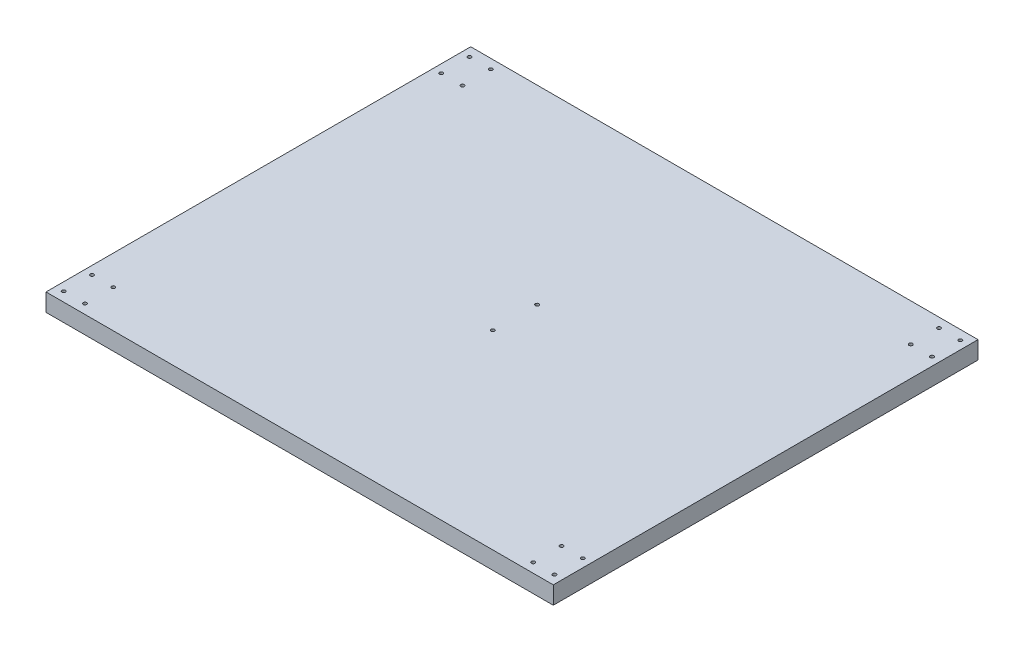
from build123d import *

# Parameters (mm, degrees)
CROQUIS1_W              = 430
CROQUIS1_H              = 360
CROQUIS1_R              = 1.5
SALIENTE_EXTRUIR1_DEPTH = 15
CROQUIS3_R              = 1.5
CORTAR_EXTRUIR1_DEPTH   = 281.802421642


with BuildPart() as part:
    # Croquis1 → Saliente-Extruir1 (new body)
    with BuildSketch(Plane(origin=(0, 0, 0), x_dir=(1, 0, 0), z_dir=(0, 1, 0))):
        Rectangle(CROQUIS1_W, CROQUIS1_H)
        with Locations(Location((2.5, 18.8, 0), (0, 0, 270))):
            Circle(CROQUIS1_R, mode=Mode.SUBTRACT)
        with Locations(Location((2.5, -18.8, 0), (0, 0, 270))):
            Circle(CROQUIS1_R, mode=Mode.SUBTRACT)
    extrude(amount=SALIENTE_EXTRUIR1_DEPTH)

    # Croquis3 → Cortar-Extruir1 (cut, through all)
    with BuildSketch(Plane(origin=(0, 15, 0), x_dir=(1, 0, 0), z_dir=(0, 1, 0))):
        with Locations(Location((208, -172, 0), (0, 0, 270))):
            Circle(CROQUIS3_R)
        with Locations(Location((190, -172, 0), (0, 0, 270))):
            Circle(CROQUIS3_R)
        with Locations(Location((190, -148, 0), (0, 0, 270))):
            Circle(CROQUIS3_R)
        with Locations(Location((208, -148, 0), (0, 0, 270))):
            Circle(CROQUIS3_R)
        with Locations(Location((-208, -172, 0), (0, 0, 90))):
            Circle(CROQUIS3_R)
        with Locations(Location((-190, -172, 0), (0, 0, 90))):
            Circle(CROQUIS3_R)
        with Locations(Location((-208, -148, 0), (0, 0, 90))):
            Circle(CROQUIS3_R)
        with Locations(Location((-190, -148, 0), (0, 0, 90))):
            Circle(CROQUIS3_R)
        with Locations(Location((-208, 172, 0), (0, 0, 270))):
            Circle(CROQUIS3_R)
        with Locations(Location((-190, 172, 0), (0, 0, 270))):
            Circle(CROQUIS3_R)
        with Locations(Location((-190, 148, 0), (0, 0, 270))):
            Circle(CROQUIS3_R)
        with Locations(Location((-208, 148, 0), (0, 0, 270))):
            Circle(CROQUIS3_R)
        with Locations(Location((208, 172, 0), (0, 0, 90))):
            Circle(CROQUIS3_R)
        with Locations(Location((190, 172, 0), (0, 0, 90))):
            Circle(CROQUIS3_R)
        with Locations(Location((190, 148, 0), (0, 0, 90))):
            Circle(CROQUIS3_R)
        with Locations(Location((208, 148, 0), (0, 0, 90))):
            Circle(CROQUIS3_R)
    extrude(amount=-CORTAR_EXTRUIR1_DEPTH, mode=Mode.SUBTRACT)


solid = part.part
